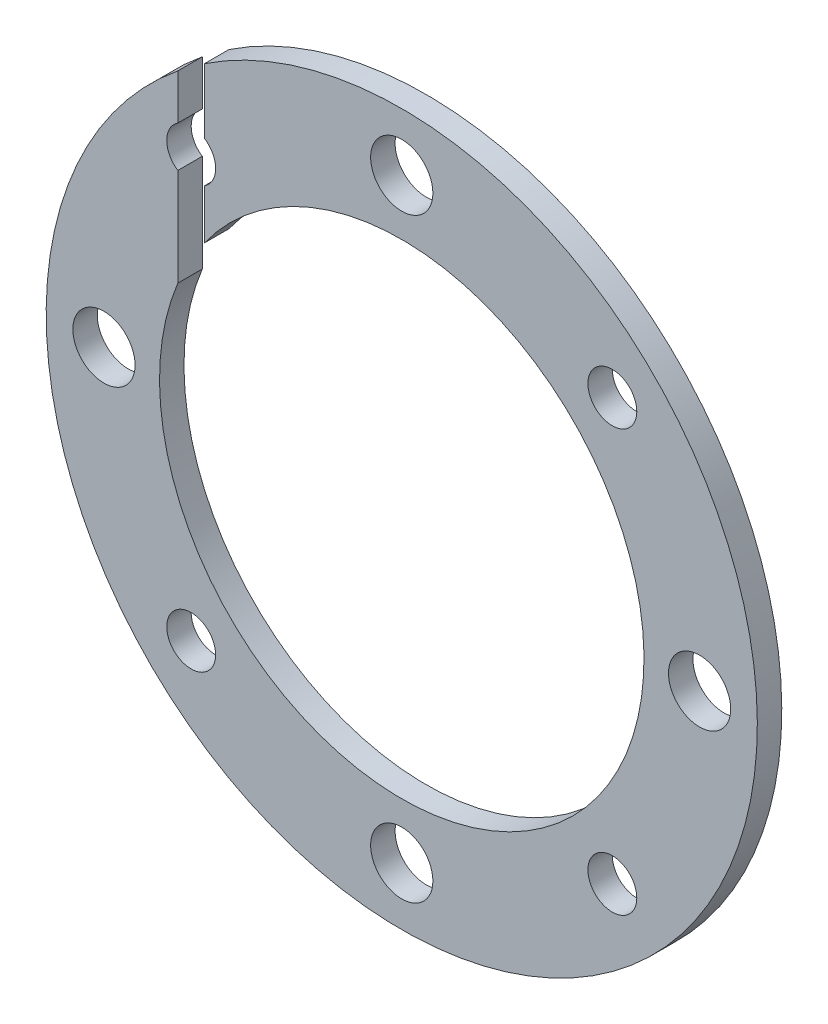
from build123d import *

# Parameters (mm, degrees)
SKETCH1_R           = 40.64
SKETCH1_R_2         = 27.686
SKETCH1_R_3         = 3.556
SKETCH1_R_4         = 2.794
BOSS_EXTRUDE1_DEPTH = 2.794
SKETCH2_W           = 3.048
SKETCH2_H           = 48.134172809
CUT_EXTRUDE1_DEPTH  = 14.097


with BuildPart() as part:
    # Sketch1 → Boss-Extrude1 (new body)
    with BuildSketch(Plane.XY):
        Circle(SKETCH1_R)
        Circle(SKETCH1_R_2, mode=Mode.SUBTRACT)
        with Locations((0, 34.036)):
            Circle(SKETCH1_R_3, mode=Mode.SUBTRACT)
        with Locations((34.036, 0)):
            Circle(SKETCH1_R_3, mode=Mode.SUBTRACT)
        with Locations((0, -34.036)):
            Circle(SKETCH1_R_3, mode=Mode.SUBTRACT)
        with Locations((-34.036, 0)):
            Circle(SKETCH1_R_3, mode=Mode.SUBTRACT)
        with Locations((24.067086404, 24.067086404)):
            Circle(SKETCH1_R_4, mode=Mode.SUBTRACT)
        with Locations((24.067086404, -24.067086404)):
            Circle(SKETCH1_R_4, mode=Mode.SUBTRACT)
        with Locations((-24.067086404, -24.067086404)):
            Circle(SKETCH1_R_4, mode=Mode.SUBTRACT)
        with Locations((-24.067086404, 24.067086404)):
            Circle(SKETCH1_R_4, mode=Mode.SUBTRACT)
    extrude(amount=BOSS_EXTRUDE1_DEPTH)

    # Sketch2 → Cut-Extrude1 (cut)
    with BuildSketch(Plane.XY.offset(2.794)):
        with Locations((-24.067086404, 24.067086405)):
            Rectangle(SKETCH2_W, SKETCH2_H)
    extrude(amount=-CUT_EXTRUDE1_DEPTH, mode=Mode.SUBTRACT)


solid = part.part
